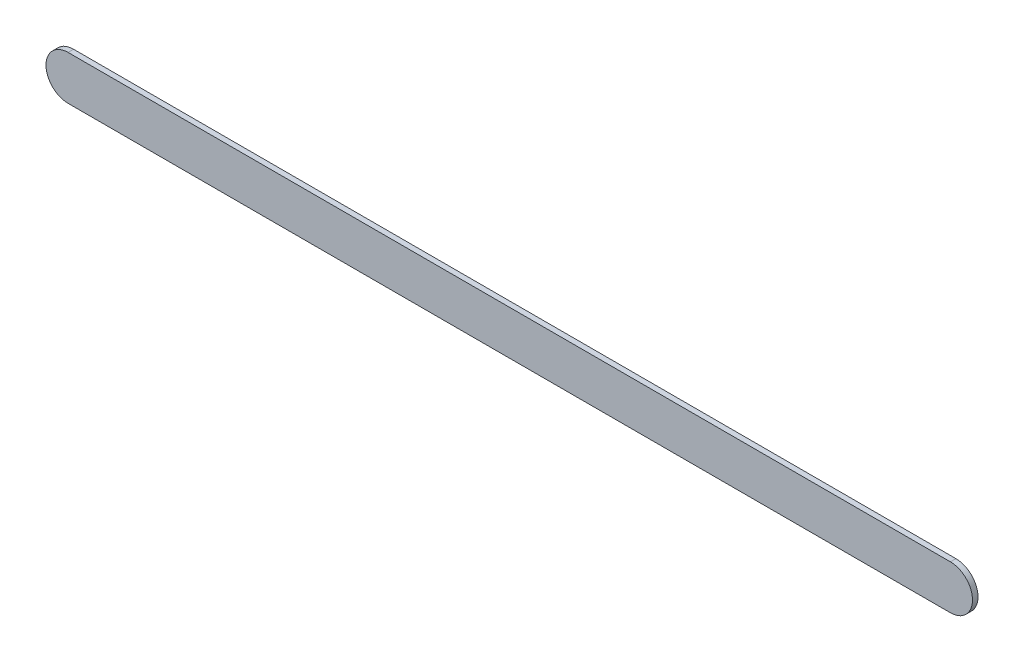
from build123d import *

# Parameters (mm, degrees)
BOSS_EXTRUDE1_DEPTH = 3.175


with BuildPart() as part:
    # Sketch1 → Boss-Extrude1 (new, symmetric)
    with BuildSketch(Plane.XY):
        with BuildLine():
            Line((508, -25.4), (-508, -25.4))
            ThreePointArc((-508, -25.4), (-533.4, 0), (-508, 25.4))
            Line((-508, 25.4), (508, 25.4))
            ThreePointArc((508, 25.4), (533.4, 0), (508, -25.4))
        make_face()
    extrude(amount=BOSS_EXTRUDE1_DEPTH, both=True)


solid = part.part
